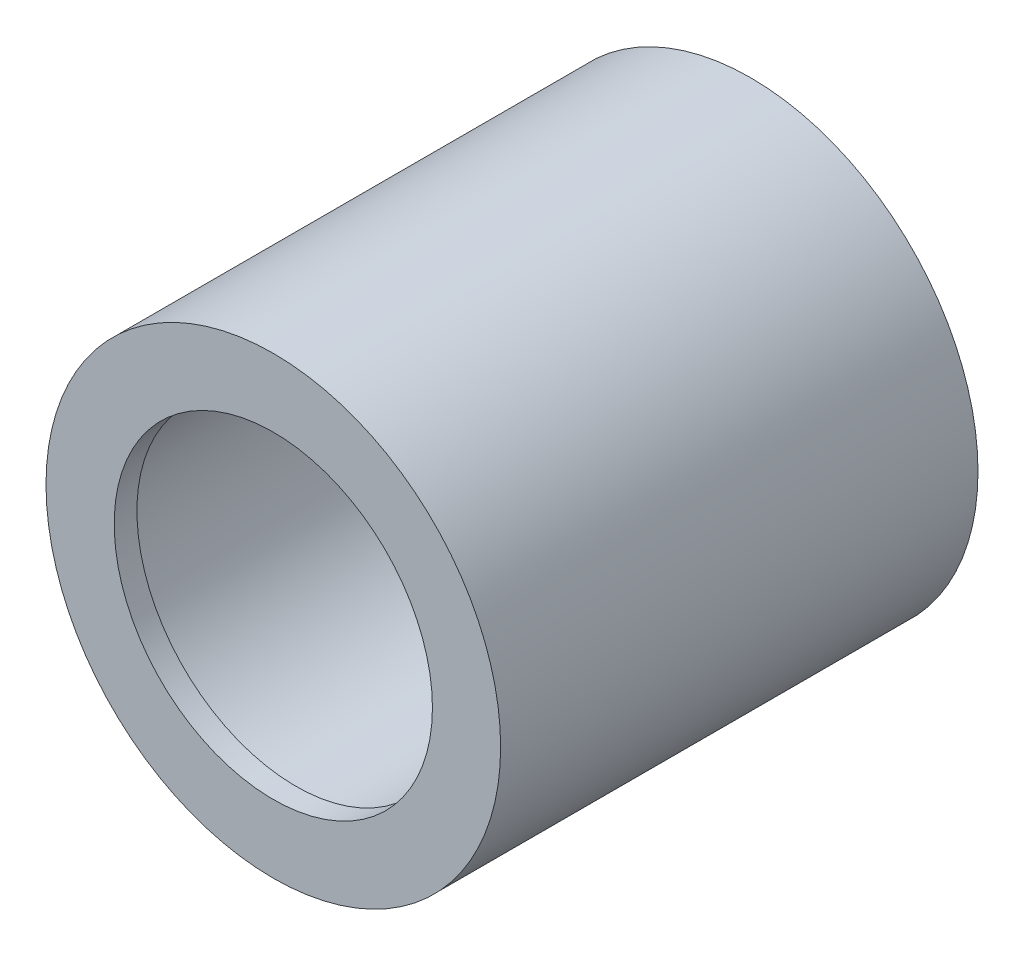
from build123d import *

# Parameters (mm, degrees)
SKETCH1_R           = 5
BOSS_EXTRUDE1_DEPTH = 10
SKETCH2_R           = 3.65
CUT_EXTRUDE1_DEPTH  = 10
CUT_EXTRUDE2_DEPTH  = 5
SKETCH5_R           = 5
SKETCH5_R_2         = 3.5
BOSS_EXTRUDE3_DEPTH = 0.5


with BuildPart() as part:
    # Sketch1 → Boss-Extrude1 (new body)
    with BuildSketch(Plane.XY):
        Circle(SKETCH1_R)
    extrude(amount=BOSS_EXTRUDE1_DEPTH)

    # Sketch2 → Cut-Extrude1 (cut)
    with BuildSketch(Plane.XY.offset(10)):
        Circle(SKETCH2_R)
    extrude(amount=-CUT_EXTRUDE1_DEPTH, mode=Mode.SUBTRACT)

    # Sketch4 → Cut-Extrude2 (cut)
    with BuildSketch(Plane(origin=(0, 0, 0), x_dir=(-1, 0, 0), z_dir=(0, 0, -1))):
        Polygon((0, 4.214656965), (-3.65, 2.107328483), (-3.65, -2.107328483), (0, -4.214656965), (3.65, -2.107328483), (3.65, 2.107328483), align=None)
    extrude(amount=-CUT_EXTRUDE2_DEPTH, mode=Mode.SUBTRACT)

    # Sketch5 → Boss-Extrude3 (add)
    with BuildSketch(Plane.XY.offset(10)):
        Circle(SKETCH5_R)
        Circle(SKETCH5_R_2, mode=Mode.SUBTRACT)
    extrude(amount=BOSS_EXTRUDE3_DEPTH)


solid = part.part
